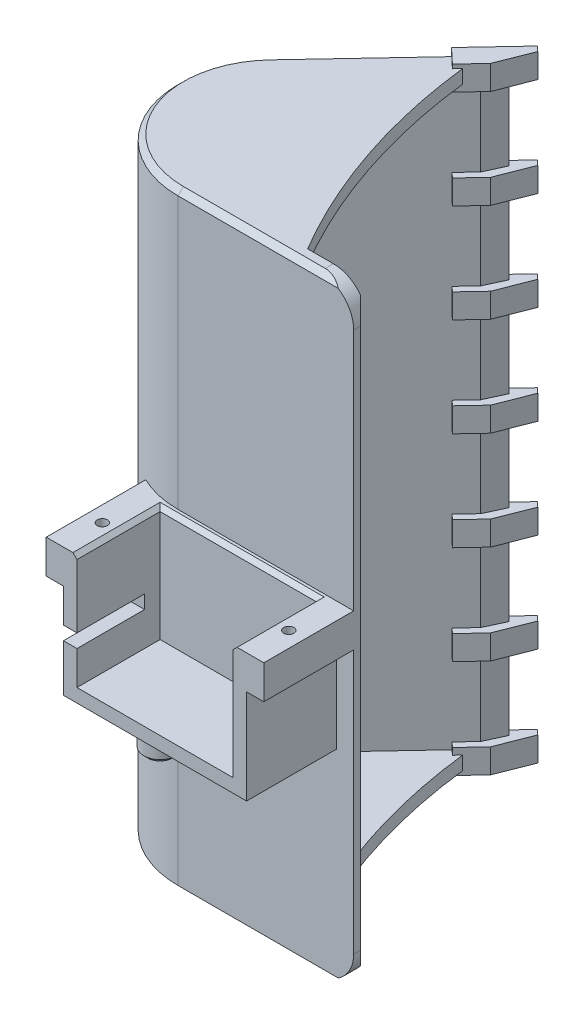
from build123d import *

# Parameters (mm, degrees)
BOSS_EXTRUDE1_DEPTH      = 17
SKETCH4_W                = 2.55
SKETCH4_H                = 15.3
SKETCH4_H_2              = 13.3
BOSS_EXTRUDE4_DEPTH      = 5
CHAMFER1_SIZE            = 0.6
SKETCH2_W                = 27.1
SKETCH2_H                = 15.3
BOSS_EXTRUDE2_DEPTH      = 2
SKETCH3_R                = 2.4
BOSS_EXTRUDE3_DEPTH      = 6
SKETCH5_R                = 0.75
CUT_EXTRUDE1_DEPTH       = 6
CUT_EXTRUDE2_REACH       = 41.661
SKETCH7_W                = 10
SKETCH7_H                = 2
BOSS_EXTRUDE5_DEPTH      = 45
BOSS_EXTRUDE5_DEPTH_BACK = 45
BOSS_EXTRUDE6_START      = -2
BOSS_EXTRUDE6_DEPTH      = 2
CHAMFER2_SIZE            = 0.6
CHAMFER4_SIZE            = 1
CHAMFER5_SIZE            = 0.8
BOSS_EXTRUDE7_START      = -3
BOSS_EXTRUDE7_DEPTH      = 3.6
LPATTERN1_COUNT          = 7
LPATTERN1_PITCH          = 14.6
FILLET1_R                = 5


with BuildPart() as part:
    # Sketch1 → Boss-Extrude1 (new body)
    with BuildSketch(Plane(origin=(0, 0, 0), x_dir=(1, 0, 0), z_dir=(0, 1, 0))):
        Polygon((-6.3, 5.3), (-6.3, -7), (-8.3, -7), (-8.3, 8.3), (18.8, 8.3), (18.8, -7), (16.8, -7), (16.8, 5.3), align=None)
    extrude(amount=-BOSS_EXTRUDE1_DEPTH)

    # Sketch4 → Boss-Extrude4 (add)
    with BuildSketch(Plane(origin=(0, 0, 0), x_dir=(1, 0, 0), z_dir=(0, 1, 0))):
        with Locations((-9.575, 0.65)):
            Rectangle(SKETCH4_W, SKETCH4_H)
        with Locations((20.075, -0.35)):
            Rectangle(SKETCH4_W, SKETCH4_H_2)
    extrude(amount=-BOSS_EXTRUDE4_DEPTH)

    # Chamfer1
    chamfer1_edges = [part.edges().sort_by_distance(p)[0] for p in [
        (16.8, 0, 0.85),
        (5.25, 0, -5.3),
        (-6.3, 0, 0.85),
    ]]
    chamfer(chamfer1_edges, length=CHAMFER1_SIZE)

    # Sketch2 → Boss-Extrude2 (add)
    with BuildSketch(Plane.XZ.offset(17)):
        with Locations((5.25, -0.65)):
            Rectangle(SKETCH2_W, SKETCH2_H)
    extrude(amount=BOSS_EXTRUDE2_DEPTH)

    # Sketch3 → Boss-Extrude3 (add)
    with BuildSketch(Plane.XZ.offset(19)):
        with Locations(Location((0, 1, 0), (0, 0, 270))):
            Circle(SKETCH3_R)
    extrude(amount=BOSS_EXTRUDE3_DEPTH)

    # Sketch5 → Cut-Extrude1 (cut)
    with BuildSketch(Plane(origin=(0, 0, 0), x_dir=(1, 0, 0), z_dir=(0, 1, 0))):
        with Locations(Location((-8.55, -1, 0), (0, 0, 270))):
            Circle(SKETCH5_R)
        with Locations(Location((19.05, -1, 0), (0, 0, 270))):
            Circle(SKETCH5_R)
    extrude(amount=-CUT_EXTRUDE1_DEPTH, mode=Mode.SUBTRACT)

    # Sketch7 → Cut-Extrude2 (cut, up to next)
    with BuildSketch(Plane.ZY.offset(8.3), mode=Mode.PRIVATE) as cut_extrude2_sk1:
        with Locations((2, -11)):
            Rectangle(SKETCH7_W, SKETCH7_H)
    cut_extrude2_tool1 = extrude(cut_extrude2_sk1.sketch, amount=-CUT_EXTRUDE2_REACH, mode=Mode.PRIVATE) & part.part
    add(cut_extrude2_tool1.solids().sort_by_distance((-8.3, -11, 2))[0], mode=Mode.SUBTRACT)

    # Sketch8 → Boss-Extrude5 (add, two sides: drawn at the far end of the back side and taken through both)
    with BuildSketch(Plane(origin=(0, -4, 1), x_dir=(1, 0, 0), z_dir=(0, 1, 0)).offset(-BOSS_EXTRUDE5_DEPTH_BACK)):
        with BuildLine():
            Line((21.35, 9.3), (-4.65, 9.3))
            ThreePointArc((-4.65, 9.3), (-15.891202985, 16.685930347), (-13.574121194, 29.935373491))
            Line((-13.574121194, 29.935373491), (1.493248773, 45.965793394))
            Line((1.493248773, 45.965793394), (2.819234682, 48.836640198))
            Line((2.819234682, 48.836640198), (2.090579232, 49.521520651))
            Line((2.090579232, 49.521520651), (-15.031432094, 31.305134397))
            ThreePointArc((-15.031432094, 31.305134397), (-17.726893838, 15.892054353), (-4.65, 7.3))
            Line((-4.65, 7.3), (21.35, 7.3))
            Line((21.35, 7.3), (21.35, 9.3))
        make_face()
    extrude(amount=BOSS_EXTRUDE5_DEPTH + BOSS_EXTRUDE5_DEPTH_BACK)

    # Sketch11 → Boss-Extrude6 (add)
    with BuildSketch(Plane(origin=(0, 41, 0), x_dir=(1, 0, 0), z_dir=(0, 1, 0)).offset(BOSS_EXTRUDE6_START)):
        with BuildLine():
            Line((0.537054569, 46.868700502), (-15.031432094, 30.305134397))
            ThreePointArc((-15.031432094, 30.305134397), (-17.726893838, 14.892054353), (-4.65, 6.3))
            Line((-4.65, 6.3), (13.753385306, 6.3))
            ThreePointArc((13.753385306, 6.3), (4.636095939, 25.766936525), (0.537054569, 46.868700502))
        make_face()
    boss_extrude6 = extrude(amount=BOSS_EXTRUDE6_DEPTH)

    # Mirror1: Boss-Extrude6 across plane
    add(boss_extrude6.mirror(Plane(origin=(0, -4, 1), x_dir=(0, 0, 1), z_dir=(0, 1, 0))))

    # Chamfer2
    chamfer2_edges = [part.edges().sort_by_distance(p)[0] for p in [
        (0, -25, 3.4),
    ]]
    chamfer(chamfer2_edges, length=CHAMFER2_SIZE)

    # Chamfer4
    chamfer4_edges = [part.edges().sort_by_distance(p)[0] for p in [
        (21.35, -4, -8.3),
    ]]
    chamfer(chamfer4_edges, length=CHAMFER4_SIZE)

    # Chamfer5
    chamfer5_edges = [part.edges().sort_by_distance(p)[0] for p in [
        (8.35, -49, -6.3),
        (-17.726893838, -49, -14.892054353),
        (-6.470426431, -49, -39.413327524),
        (-6.470426431, 41, -39.413327524),
        (-17.726893838, 41, -14.892054353),
        (8.35, 41, -6.3),
    ]]
    chamfer(chamfer5_edges, length=CHAMFER5_SIZE)

    # Sketch12 → Boss-Extrude7 (add)
    with BuildSketch(Plane(origin=(0, 41, 0), x_dir=(1, 0, 0), z_dir=(0, 1, 0)).offset(BOSS_EXTRUDE7_START)):
        Polygon((-2.018703486, 44.14958795), (4.145220591, 50.707487001), (4.873876041, 50.022606548), (2.906784676, 45.009568392), (0.167262864, 42.094946591), align=None)
    boss_extrude7 = extrude(amount=BOSS_EXTRUDE7_DEPTH)

    # LPattern1: Boss-Extrude7 ×7
    with Locations(*[(0, -i * LPATTERN1_PITCH, 0) for i in range(1, LPATTERN1_COUNT)]):
        add(boss_extrude7)

    # Fillet1
    fillet1_edges = [part.edges().sort_by_distance(p)[0] for p in [
        (21.35, 41, -7.2),
        (21.35, -49, -7.2),
    ]]
    fillet(fillet1_edges, radius=FILLET1_R)


solid = part.part
